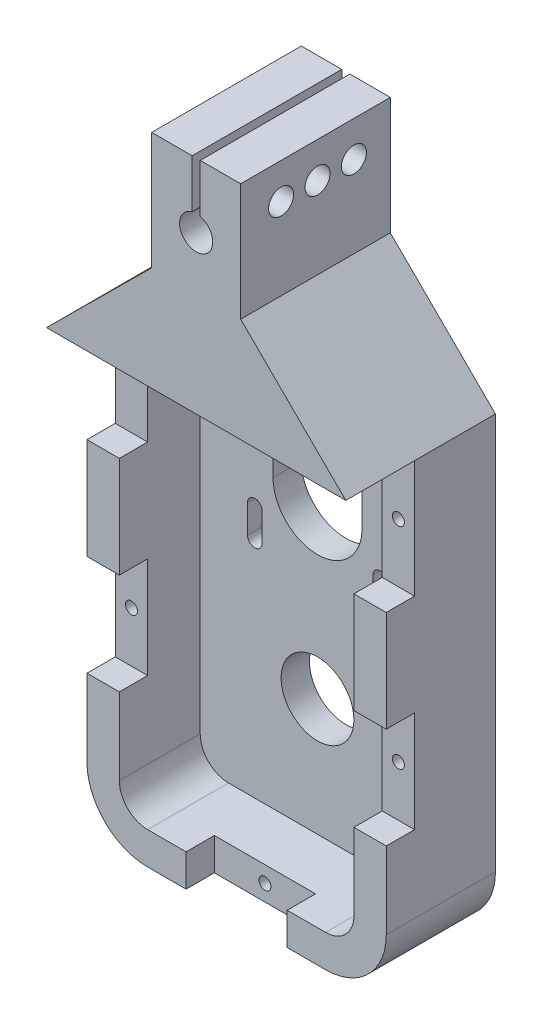
from build123d import *

# Parameters (mm, degrees)
CROQUIS2_R              = 9
SALIENTE_EXTRUIR1_DEPTH = 7
CROQUIS2_7_W            = 25
CROQUIS2_7_H            = 8
CROQUIS2_7_W_2          = 8
CROQUIS2_7_H_2          = 25
SALIENTE_EXTRUIR3_DEPTH = 27
CROQUIS2_12_W           = 8
CROQUIS2_12_H           = 25
CROQUIS2_12_W_2         = 25
CROQUIS2_12_H_2         = 8
SALIENTE_EXTRUIR4_DEPTH = 20
SALIENTE_EXTRUIR5_DEPTH = 37
CROQUIS4_R              = 1.475
CORTAR_EXTRUIR2_DEPTH   = 14
CROQUIS10_R             = 1.9
CORTAR_EXTRUIR3_DEPTH   = 22
CROQUIS11_R             = 3.1
CORTAR_EXTRUIR4_DEPTH   = 6
CORTAR_EXTRUIR5_DEPTH   = 6


with BuildPart() as part:
    # Croquis2 → Saliente-Extruir1 (new body)
    with BuildSketch(Plane.XY):
        with BuildLine():
            Line((-5.786620614, 40.816010109), (-30.786620614, 40.816010109))
            Line((-30.786620614, 40.816010109), (-47.286620614, 40.816010109))
            Line((-47.286620614, 40.816010109), (-47.286620614, 19.816010109))
            Line((-47.286620614, 19.816010109), (-47.286620614, -5.183989891))
            Line((-47.286620614, -5.183989891), (-47.286620614, -30.183989891))
            Line((-47.286620614, -30.183989891), (-47.286620614, -49.183989891))
            ThreePointArc((-47.286620614, -49.183989891), (-45.236368082, -54.133737359), (-40.286620614, -56.183989891))
            Line((-40.286620614, -56.183989891), (-30.786620614, -56.183989891))
            Line((-30.786620614, -56.183989891), (-5.786620614, -56.183989891))
            Line((-5.786620614, -56.183989891), (3.713379386, -56.183989891))
            ThreePointArc((3.713379386, -56.183989891), (8.663126854, -54.133737359), (10.713379386, -49.183989891))
            Line((10.713379386, -49.183989891), (10.713379386, -30.183989891))
            Line((10.713379386, -30.183989891), (10.713379386, -5.183989891))
            Line((10.713379386, -5.183989891), (10.713379386, 19.816010109))
            Line((10.713379386, 19.816010109), (10.713379386, 40.816010109))
            Line((10.713379386, 40.816010109), (-5.786620614, 40.816010109))
        make_face()
        with Locations((-18.286620614, -27.183989891)):
            Circle(CROQUIS2_R, mode=Mode.SUBTRACT)
        with BuildLine():
            ThreePointArc((-35.586620614, 6.205288522), (-33.786620614, 8.005288522), (-31.986620614, 6.205288522))
            Line((-31.986620614, 6.205288522), (-31.986620614, -0.794711478))
            ThreePointArc((-31.986620614, -0.794711478), (-33.786620614, -2.594711478), (-35.586620614, -0.794711478))
            Line((-35.586620614, -0.794711478), (-35.586620614, 6.205288522))
        make_face(mode=Mode.SUBTRACT)
        with BuildLine():
            ThreePointArc((-29.286620614, 21.705288522), (-18.286620614, 32.705288522), (-7.286620614, 21.705288522))
            Line((-7.286620614, 21.705288522), (-7.286620614, 14.705288522))
            ThreePointArc((-7.286620614, 14.705288522), (-18.286620614, 3.705288522), (-29.286620614, 14.705288522))
            Line((-29.286620614, 14.705288522), (-29.286620614, 21.705288522))
        make_face(mode=Mode.SUBTRACT)
        with BuildLine():
            ThreePointArc((-4.586620614, 6.205288522), (-2.786620614, 8.005288522), (-0.986620614, 6.205288522))
            Line((-0.986620614, 6.205288522), (-0.986620614, -0.794711478))
            ThreePointArc((-0.986620614, -0.794711478), (-2.786620614, -2.594711478), (-4.586620614, -0.794711478))
            Line((-4.586620614, -0.794711478), (-4.586620614, 6.205288522))
        make_face(mode=Mode.SUBTRACT)
        with BuildLine():
            ThreePointArc((-31.986620614, 30.205288522), (-33.786620614, 28.405288522), (-35.586620614, 30.205288522))
            Line((-35.586620614, 30.205288522), (-35.586620614, 37.205288522))
            ThreePointArc((-35.586620614, 37.205288522), (-33.786620614, 39.005288522), (-31.986620614, 37.205288522))
            Line((-31.986620614, 37.205288522), (-31.986620614, 30.205288522))
        make_face(mode=Mode.SUBTRACT)
        with BuildLine():
            ThreePointArc((-0.986620614, 30.205288522), (-2.786620614, 28.405288522), (-4.586620614, 30.205288522))
            Line((-4.586620614, 30.205288522), (-4.586620614, 37.205288522))
            ThreePointArc((-4.586620614, 37.205288522), (-2.786620614, 39.005288522), (-0.986620614, 37.205288522))
            Line((-0.986620614, 37.205288522), (-0.986620614, 30.205288522))
        make_face(mode=Mode.SUBTRACT)
    extrude(amount=SALIENTE_EXTRUIR1_DEPTH)

    # Croquis2<7> → Saliente-Extruir3 (add)
    with BuildSketch(Plane.XY):
        with Locations((-18.286620614, 44.816010109)):
            Rectangle(CROQUIS2_7_W, CROQUIS2_7_H)
        with Locations((-51.286620614, 7.316010109)):
            Rectangle(CROQUIS2_7_W_2, CROQUIS2_7_H_2)
        with Locations((14.713379386, 7.316010109)):
            Rectangle(CROQUIS2_7_W_2, CROQUIS2_7_H_2)
        with BuildLine():
            Line((-47.286620614, -30.183989891), (-55.286620614, -30.183989891))
            Line((-55.286620614, -30.183989891), (-55.286620614, -49.183989891))
            ThreePointArc((-55.286620614, -49.183989891), (-50.893222332, -59.790591609), (-40.286620614, -64.183989891))
            Line((-40.286620614, -64.183989891), (-30.786620614, -64.183989891))
            Line((-30.786620614, -64.183989891), (-30.786620614, -56.183989891))
            Line((-30.786620614, -56.183989891), (-40.286620614, -56.183989891))
            ThreePointArc((-40.286620614, -56.183989891), (-45.236368082, -54.133737359), (-47.286620614, -49.183989891))
            Line((-47.286620614, -49.183989891), (-47.286620614, -30.183989891))
        make_face()
        with BuildLine():
            Line((18.713379386, -49.183989891), (18.713379386, -30.183989891))
            Line((18.713379386, -30.183989891), (10.713379386, -30.183989891))
            Line((10.713379386, -30.183989891), (10.713379386, -49.183989891))
            ThreePointArc((10.713379386, -49.183989891), (8.663126854, -54.133737359), (3.713379386, -56.183989891))
            Line((3.713379386, -56.183989891), (-5.786620614, -56.183989891))
            Line((-5.786620614, -56.183989891), (-5.786620614, -64.183989891))
            Line((-5.786620614, -64.183989891), (3.713379386, -64.183989891))
            ThreePointArc((3.713379386, -64.183989891), (14.319981104, -59.790591609), (18.713379386, -49.183989891))
        make_face()
    extrude(amount=SALIENTE_EXTRUIR3_DEPTH)

    # Croquis2<12> → Saliente-Extruir4 (add)
    with BuildSketch(Plane.XY):
        Polygon((-30.786620614, 40.816010109), (-30.786620614, 48.816010109), (-55.286620614, 48.816010109), (-55.286620614, 19.816010109), (-47.286620614, 19.816010109), (-47.286620614, 40.816010109), align=None)
        Polygon((18.713379386, 48.816010109), (-5.786620614, 48.816010109), (-5.786620614, 40.816010109), (10.713379386, 40.816010109), (10.713379386, 19.816010109), (18.713379386, 19.816010109), align=None)
        with Locations((-51.286620614, -17.683989891)):
            Rectangle(CROQUIS2_12_W, CROQUIS2_12_H)
        with Locations((14.713379386, -17.683989891)):
            Rectangle(CROQUIS2_12_W, CROQUIS2_12_H)
        with Locations((-18.286620614, -60.183989891)):
            Rectangle(CROQUIS2_12_W_2, CROQUIS2_12_H_2)
    extrude(amount=SALIENTE_EXTRUIR4_DEPTH)

    # Croquis2<14> → Saliente-Extruir5 (add)
    with BuildSketch(Plane.XY):
        with BuildLine():
            Line((-55.286620614, 48.816010109), (-30.786620614, 48.816010109))
            Line((-30.786620614, 48.816010109), (-5.786620614, 48.816010109))
            Line((-5.786620614, 48.816010109), (18.713379386, 48.816010109))
            Line((18.713379386, 48.816010109), (-7.286620614, 74.616010109))
            Line((-7.286620614, 74.616010109), (-7.286620614, 103.616010109))
            Line((-7.286620614, 103.616010109), (-17.286620614, 103.616010109))
            Line((-17.286620614, 103.616010109), (-17.286620614, 91.616010109))
            ThreePointArc((-17.286620614, 91.616010109), (-18.286620614, 83.539831039), (-19.286620614, 91.616010109))
            Line((-19.286620614, 91.616010109), (-19.286620614, 103.616010109))
            Line((-19.286620614, 103.616010109), (-29.286620614, 103.616010109))
            Line((-29.286620614, 103.616010109), (-29.286620614, 74.616010109))
            Line((-29.286620614, 74.616010109), (-55.286620614, 48.816010109))
        make_face()
    extrude(amount=SALIENTE_EXTRUIR5_DEPTH)

    # Croquis4 → Cortar-Extruir2 (cut)
    with BuildSketch(Plane.XY.offset(27)):
        with Locations((-51.286620614, 34.316010109)):
            Circle(CROQUIS4_R)
        with Locations((-51.286620614, -17.683989891)):
            Circle(CROQUIS4_R)
        with Locations((-18.286620614, -60.183989891)):
            Circle(CROQUIS4_R)
        with Locations((14.713379386, -17.683989891)):
            Circle(CROQUIS4_R)
        with Locations((14.713379386, 34.316010109)):
            Circle(CROQUIS4_R)
    extrude(amount=-CORTAR_EXTRUIR2_DEPTH, mode=Mode.SUBTRACT)

    # Croquis10 → Cortar-Extruir3 (cut)
    with BuildSketch(Plane(origin=(-7.286620614, 0, 0), x_dir=(0, 0, -1), z_dir=(1, 0, 0))):
        with Locations((-9, 94.816010109)):
            Circle(CROQUIS10_R)
        with Locations((-18, 94.816010109)):
            Circle(CROQUIS10_R)
        with Locations((-27, 94.816010109)):
            Circle(CROQUIS10_R)
    extrude(amount=-CORTAR_EXTRUIR3_DEPTH, mode=Mode.SUBTRACT)

    # Croquis11 → Cortar-Extruir4 (cut)
    with BuildSketch(Plane(origin=(-7.286620614, 0, 0), x_dir=(0, 0, -1), z_dir=(1, 0, 0))):
        with Locations((-27, 94.816010109)):
            Circle(CROQUIS11_R)
        with Locations((-18, 94.816010109)):
            Circle(CROQUIS11_R)
        with Locations((-9, 94.816010109)):
            Circle(CROQUIS11_R)
    extrude(amount=-CORTAR_EXTRUIR4_DEPTH, mode=Mode.SUBTRACT)

    # Croquis12 → Cortar-Extruir5 (cut)
    with BuildSketch(Plane.ZY.offset(29.286620614)):
        Polygon((21.233161507, 94.816010109), (19.616580754, 97.616010109), (16.383419246, 97.616010109), (14.766838493, 94.816010109), (16.383419246, 92.016010109), (19.616580754, 92.016010109), align=None)
        Polygon((12.233161507, 94.816010109), (10.616580754, 97.616010109), (7.383419246, 97.616010109), (5.766838493, 94.816010109), (7.383419246, 92.016010109), (10.616580754, 92.016010109), align=None)
        Polygon((30.233161507, 94.816010109), (28.616580754, 97.616010109), (25.383419246, 97.616010109), (23.766838493, 94.816010109), (25.383419246, 92.016010109), (28.616580754, 92.016010109), align=None)
    extrude(amount=-CORTAR_EXTRUIR5_DEPTH, mode=Mode.SUBTRACT)


solid = part.part
